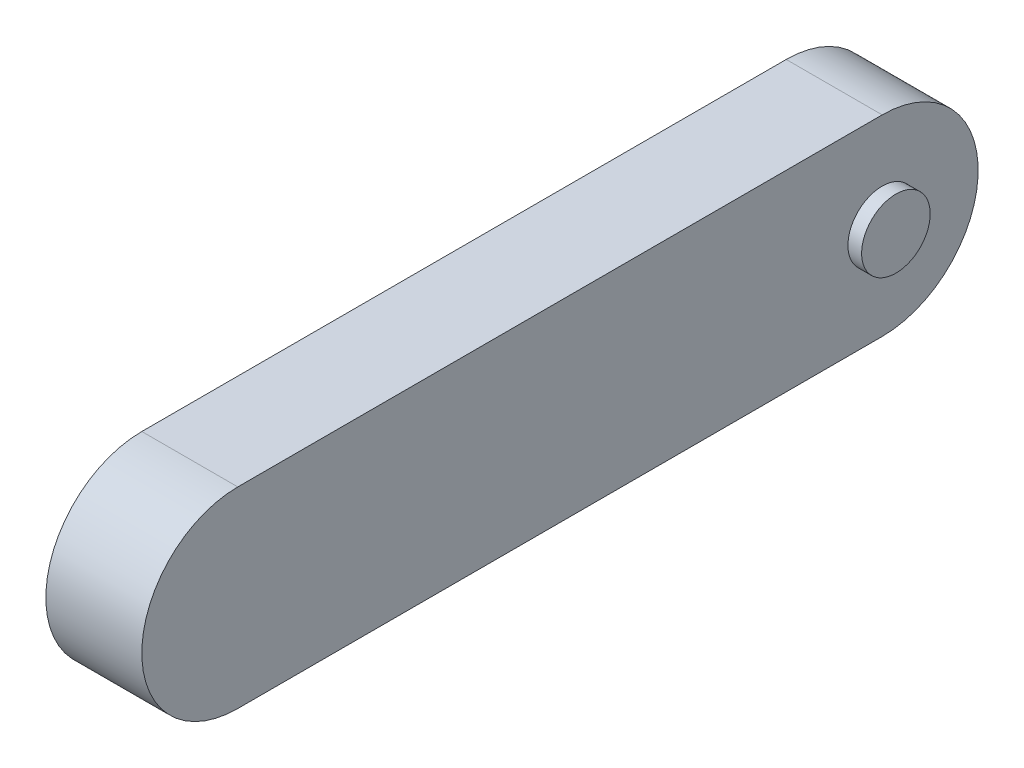
from build123d import *

# Parameters (mm, degrees)
SKETCH3_R           = 70
BOSS_EXTRUDE1_DEPTH = 70
SKETCH4_R           = 25
BOSS_EXTRUDE2_DEPTH = 10
BOSS_EXTRUDE3_START = 10
SKETCH6_R           = 25
BOSS_EXTRUDE3_DEPTH = 10
SKETCH7_W           = 70
SKETCH7_H           = 400
BOSS_EXTRUDE4_DEPTH = 140
BOSS_EXTRUDE5_START = -70
BOSS_EXTRUDE5_DEPTH = 70
BOSS_EXTRUDE6_DEPTH = 70


with BuildPart() as part:
    # Sketch3 → Boss-Extrude1 (new body)
    with BuildSketch(Plane(origin=(0, 0, 0), x_dir=(0, 0, -1), z_dir=(1, 0, 0))):
        Circle(SKETCH3_R)
    extrude(amount=BOSS_EXTRUDE1_DEPTH)

    # Sketch4 → Boss-Extrude2 (add)
    with BuildSketch(Plane(origin=(0, 0, 0), x_dir=(0, 0, -1), z_dir=(1, 0, 0))):
        Circle(SKETCH4_R)
    extrude(amount=-BOSS_EXTRUDE2_DEPTH)

    # Sketch6 → Boss-Extrude3 (add)
    with BuildSketch(Plane(origin=(70, 0, 0), x_dir=(0, 0, -1), z_dir=(1, 0, 0)).offset(BOSS_EXTRUDE3_START)):
        Circle(SKETCH6_R)
    extrude(amount=-BOSS_EXTRUDE3_DEPTH)



with BuildPart() as body_2:
    # Sketch7 → Boss-Extrude4 (new body)
    with BuildSketch(Plane(origin=(0, 70, 0), x_dir=(1, 0, 0), z_dir=(0, 1, 0))):
        with Locations((35, -270)):
            Rectangle(SKETCH7_W, SKETCH7_H)
    extrude(amount=-BOSS_EXTRUDE4_DEPTH)


with BuildPart() as part_1:
    add(part.part)

    add(body_2.part)  # Boss-Extrude5 merges body 2
    # Sketch8 → Boss-Extrude5 (add)
    with BuildSketch(Plane(origin=(70, 0, 0), x_dir=(0, 0, -1), z_dir=(1, 0, 0)).offset(BOSS_EXTRUDE5_START)):
        with BuildLine():
            ThreePointArc((-70, -2.7e-08), (-49.497474693, 49.497474674), (0, 70))
            Line((0, 70), (-70, 70))
            Line((-70, 70), (-70, -2.7e-08))
        make_face()
        with BuildLine():
            ThreePointArc((0, -70), (-49.497474674, -49.497474693), (-70, -2.7e-08))
            Line((-70, -2.7e-08), (-70, -70))
            Line((-70, -70), (0, -70))
        make_face()
    extrude(amount=BOSS_EXTRUDE5_DEPTH)

    # Sketch9 → Boss-Extrude6 (add)
    with BuildSketch(Plane(origin=(0, 0, 0), x_dir=(0, 0, -1), z_dir=(1, 0, 0))):
        with BuildLine():
            Line((-470, 70), (-470, -70))
            ThreePointArc((-470, -70), (-540, 0), (-470, 70))
        make_face()
    extrude(amount=BOSS_EXTRUDE6_DEPTH)


solid = part_1.part
